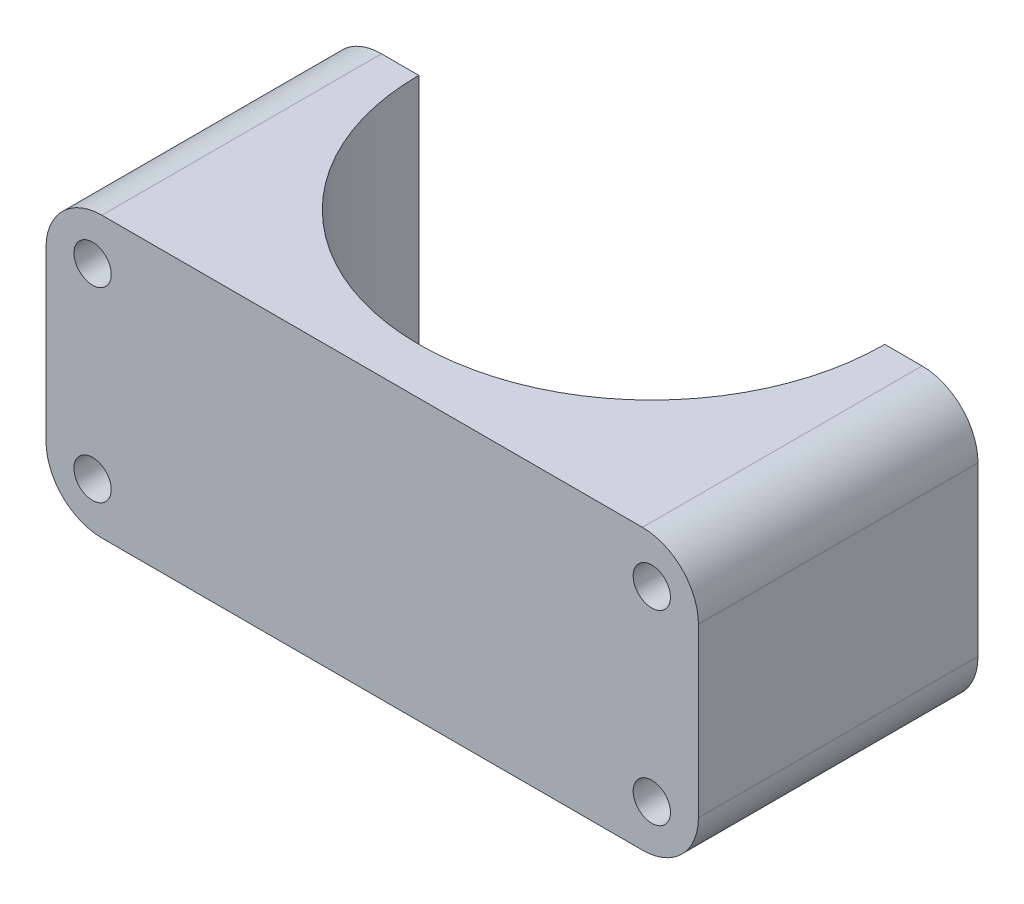
from build123d import *

# Parameters (mm, degrees)
RESSALTO_EXTRUS_O1_DEPTH = 15
ESBO_O2_R                = 1
CORTE_EXTRUS_O1_DEPTH    = 41.926763859
FILETE1_R                = 3


with BuildPart() as part:
    # Esboço1 → Ressalto-extrusão1 (new body)
    with BuildSketch(Plane(origin=(0, 0, 0), x_dir=(1, 0, 0), z_dir=(0, 1, 0))):
        with BuildLine():
            Line((0, 15), (0, 0))
            Line((0, 0), (35, 0))
            Line((35, 0), (35, 15))
            Line((35, 15), (30, 15))
            ThreePointArc((30, 15), (17.5, 2.5), (5, 15))
            Line((5, 15), (0, 15))
        make_face()
    extrude(amount=RESSALTO_EXTRUS_O1_DEPTH)

    # Esboço2 → Corte-extrusão1 (cut, through all)
    with BuildSketch(Plane(origin=(0, 0, -15), x_dir=(-1, 0, 0), z_dir=(0, 0, -1))):
        with Locations((-32.5, 12.5)):
            Circle(ESBO_O2_R)
        with Locations((-32.5, 2.5)):
            Circle(ESBO_O2_R)
        with Locations((-2.5, 2.5)):
            Circle(ESBO_O2_R)
        with Locations((-2.5, 12.5)):
            Circle(ESBO_O2_R)
    extrude(amount=-CORTE_EXTRUS_O1_DEPTH, mode=Mode.SUBTRACT)

    # Filete1
    filete1_edges = [part.edges().sort_by_distance(p)[0] for p in [
        (0, 15, -7.5),
        (35, 15, -7.5),
        (0, 0, -7.5),
        (35, 0, -7.5),
    ]]
    fillet(filete1_edges, radius=FILETE1_R)


solid = part.part
